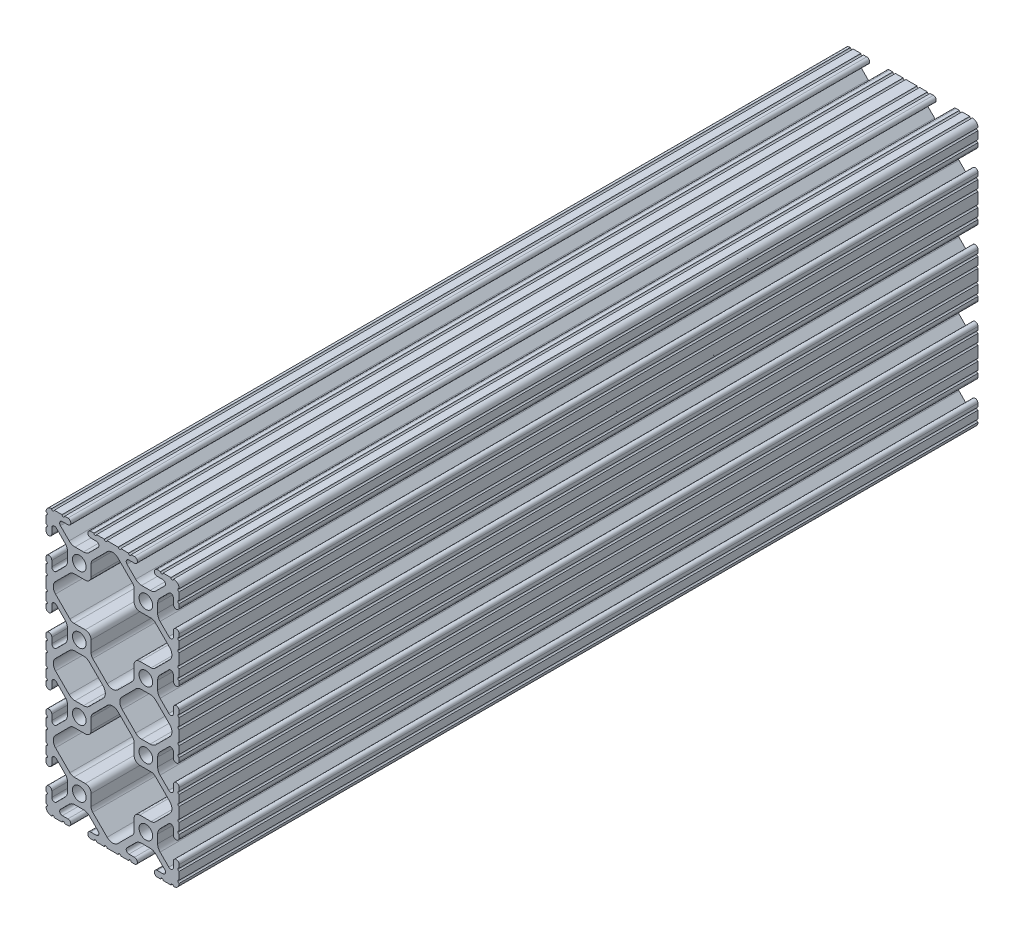
from build123d import *

# Parameters (mm, degrees)
SKETCH1_R      = 2.6035
EXTRUDE1_DEPTH = 304.8


with BuildPart() as part:
    # Sketch1 → Extrude1 (new body)
    with BuildSketch(Plane.XY):
        with BuildLine():
            Line((-12.699984366, 40.2336), (-12.699984366, 35.9664))
            ThreePointArc((-12.699984366, 35.9664), (-12.192, 35.458392183), (-12.7, 34.9504))
            Line((-12.7, 34.9504), (-12.7, 32.004))
            ThreePointArc((-12.7, 32.004), (-12.192, 31.496), (-12.7, 30.988))
            Line((-12.7, 30.988), (-12.7, 29.7434))
            ThreePointArc((-12.7, 29.7434), (-11.5951, 28.6385), (-10.4902, 29.7434))
            Line((-10.4902, 29.7434), (-10.4902, 31.874256981))
            ThreePointArc((-10.4902, 31.874256981), (-9.863010627, 32.812916821), (-8.755786031, 32.592683991))
            Line((-8.755786031, 32.592683991), (-5.425756348, 29.262714761))
            ThreePointArc((-5.425756348, 29.262714761), (-4.737487999, 28.232663563), (-4.4958, 27.017630353))
            Line((-4.4958, 27.017630353), (-4.4958, 23.782369647))
            ThreePointArc((-4.4958, 23.782369647), (-4.737487999, 22.567336437), (-5.425756348, 21.537285239))
            Line((-5.425756348, 21.537285239), (-8.755786031, 18.207316009))
            ThreePointArc((-8.755786031, 18.207316009), (-9.863010627, 17.987083179), (-10.4902, 18.925743019))
            Line((-10.4902, 18.925743019), (-10.4902, 21.0566))
            ThreePointArc((-10.4902, 21.0566), (-11.5951, 22.1615), (-12.7, 21.0566))
            Line((-12.7, 21.0566), (-12.7, 19.812))
            ThreePointArc((-12.7, 19.812), (-12.192, 19.304), (-12.7, 18.796))
            Line((-12.7, 18.796), (-12.7, 15.8496))
            ThreePointArc((-12.7, 15.8496), (-12.192, 15.341607817), (-12.699984366, 14.8336))
            Line((-12.699984366, 14.8336), (-12.699984366, 10.5664))
            ThreePointArc((-12.699984366, 10.5664), (-12.192, 10.0584), (-12.699984366, 9.5504))
            Line((-12.699984366, 9.5504), (-12.699984366, 6.604))
            ThreePointArc((-12.699984366, 6.604), (-12.192, 6.095992183), (-12.7, 5.588))
            Line((-12.7, 5.588), (-12.7, 4.3434))
            ThreePointArc((-12.7, 4.3434), (-11.5951, 3.2385), (-10.4902, 4.3434))
            Line((-10.4902, 4.3434), (-10.4902, 6.474256981))
            ThreePointArc((-10.4902, 6.474256981), (-9.863010627, 7.412916821), (-8.755786031, 7.192683991))
            Line((-8.755786031, 7.192683991), (-5.425756348, 3.862714761))
            ThreePointArc((-5.425756348, 3.862714761), (-4.737487999, 2.832663563), (-4.4958, 1.617630353))
            Line((-4.4958, 1.617630353), (-4.4958, -1.617630353))
            ThreePointArc((-4.4958, -1.617630353), (-4.737487999, -2.832663563), (-5.425756348, -3.862714761))
            Line((-5.425756348, -3.862714761), (-8.755786031, -7.192683991))
            ThreePointArc((-8.755786031, -7.192683991), (-9.863010627, -7.412916821), (-10.4902, -6.474256981))
            Line((-10.4902, -6.474256981), (-10.4902, -4.3434))
            ThreePointArc((-10.4902, -4.3434), (-11.5951, -3.2385), (-12.7, -4.3434))
            Line((-12.7, -4.3434), (-12.7, -5.588))
            ThreePointArc((-12.7, -5.588), (-12.192, -6.096), (-12.7, -6.604))
            Line((-12.7, -6.604), (-12.7, -9.5504))
            ThreePointArc((-12.7, -9.5504), (-12.192000007, -10.058315768), (-12.699831537, -10.566399972))
            ThreePointArc((-12.699831537, -10.566399972), (-12.082506882, -12.082506882), (-10.566399972, -12.699831537))
            ThreePointArc((-10.566399972, -12.699831537), (-10.058315768, -12.192000007), (-9.5504, -12.7))
            Line((-9.5504, -12.7), (-6.604, -12.7))
            ThreePointArc((-6.604, -12.7), (-6.096, -12.192), (-5.588, -12.7))
            Line((-5.588, -12.7), (-4.3434, -12.7))
            ThreePointArc((-4.3434, -12.7), (-3.2385, -11.5951), (-4.3434, -10.4902))
            Line((-4.3434, -10.4902), (-6.474256981, -10.4902))
            ThreePointArc((-6.474256981, -10.4902), (-7.412916821, -9.863010627), (-7.192683991, -8.755786031))
            Line((-7.192683991, -8.755786031), (-3.862714761, -5.425756348))
            ThreePointArc((-3.862714761, -5.425756348), (-2.832663563, -4.737487999), (-1.617630353, -4.4958))
            Line((-1.617630353, -4.4958), (1.617630353, -4.4958))
            ThreePointArc((1.617630353, -4.4958), (2.832663563, -4.737487999), (3.862714761, -5.425756348))
            Line((3.862714761, -5.425756348), (7.192683991, -8.755786031))
            ThreePointArc((7.192683991, -8.755786031), (7.412916821, -9.863010627), (6.474256981, -10.4902))
            Line((6.474256981, -10.4902), (4.3434, -10.4902))
            ThreePointArc((4.3434, -10.4902), (3.2385, -11.5951), (4.3434, -12.7))
            Line((4.3434, -12.7), (5.588, -12.7))
            ThreePointArc((5.588, -12.7), (6.096, -12.192), (6.604, -12.7))
            Line((6.604, -12.7), (9.5504, -12.7))
            ThreePointArc((9.5504, -12.7), (10.0584, -12.192), (10.5664, -12.7))
            Line((10.5664, -12.7), (14.8336, -12.7))
            ThreePointArc((14.8336, -12.7), (15.3416, -12.192), (15.8496, -12.7))
            Line((15.8496, -12.7), (18.796, -12.7))
            ThreePointArc((18.796, -12.7), (19.304, -12.192), (19.812, -12.7))
            Line((19.812, -12.7), (21.0566, -12.7))
            ThreePointArc((21.0566, -12.7), (22.1615, -11.5951), (21.0566, -10.4902))
            Line((21.0566, -10.4902), (18.925743019, -10.4902))
            ThreePointArc((18.925743019, -10.4902), (17.987083179, -9.863010627), (18.207316009, -8.755786031))
            Line((18.207316009, -8.755786031), (21.537285239, -5.425756348))
            ThreePointArc((21.537285239, -5.425756348), (22.567336437, -4.737487999), (23.782369647, -4.4958))
            Line((23.782369647, -4.4958), (27.017630353, -4.4958))
            ThreePointArc((27.017630353, -4.4958), (28.232663563, -4.737487999), (29.262714761, -5.425756348))
            Line((29.262714761, -5.425756348), (32.592683991, -8.755786031))
            ThreePointArc((32.592683991, -8.755786031), (32.812916821, -9.863010627), (31.874256981, -10.4902))
            Line((31.874256981, -10.4902), (29.7434, -10.4902))
            ThreePointArc((29.7434, -10.4902), (28.6385, -11.5951), (29.7434, -12.7))
            Line((29.7434, -12.7), (30.988, -12.7))
            ThreePointArc((30.988, -12.7), (31.496, -12.192), (32.004, -12.7))
            Line((32.004, -12.7), (34.9504, -12.7))
            ThreePointArc((34.9504, -12.7), (35.458315768, -12.192000007), (35.966399972, -12.699831537))
            ThreePointArc((35.966399972, -12.699831537), (37.482506882, -12.082506882), (38.099831537, -10.566399972))
            ThreePointArc((38.099831537, -10.566399972), (37.592000007, -10.058315768), (38.1, -9.5504))
            Line((38.1, -9.5504), (38.1, -6.604))
            ThreePointArc((38.1, -6.604), (37.592, -6.096), (38.1, -5.588))
            Line((38.1, -5.588), (38.1, -4.3434))
            ThreePointArc((38.1, -4.3434), (36.9951, -3.2385), (35.8902, -4.3434))
            Line((35.8902, -4.3434), (35.8902, -6.474256981))
            ThreePointArc((35.8902, -6.474256981), (35.263010627, -7.412916821), (34.155786031, -7.192683991))
            Line((34.155786031, -7.192683991), (30.825756348, -3.862714761))
            ThreePointArc((30.825756348, -3.862714761), (30.137487999, -2.832663563), (29.8958, -1.617630353))
            Line((29.8958, -1.617630353), (29.8958, 1.617630353))
            ThreePointArc((29.8958, 1.617630353), (30.137487999, 2.832663563), (30.825756348, 3.862714761))
            Line((30.825756348, 3.862714761), (34.155786031, 7.192683991))
            ThreePointArc((34.155786031, 7.192683991), (35.263010627, 7.412916821), (35.8902, 6.474256981))
            Line((35.8902, 6.474256981), (35.8902, 4.3434))
            ThreePointArc((35.8902, 4.3434), (36.9951, 3.2385), (38.1, 4.3434))
            Line((38.1, 4.3434), (38.1, 5.588))
            ThreePointArc((38.1, 5.588), (37.592, 6.096), (38.1, 6.604))
            Line((38.1, 6.604), (38.1, 9.5504))
            ThreePointArc((38.1, 9.5504), (37.592, 10.058392183), (38.099984366, 10.5664))
            Line((38.099984366, 10.5664), (38.099984366, 14.8336))
            ThreePointArc((38.099984366, 14.8336), (37.592, 15.3416), (38.099984366, 15.8496))
            Line((38.099984366, 15.8496), (38.099984366, 18.796))
            ThreePointArc((38.099984366, 18.796), (37.592, 19.304007817), (38.1, 19.812))
            Line((38.1, 19.812), (38.1, 21.0566))
            ThreePointArc((38.1, 21.0566), (36.9951, 22.1615), (35.8902, 21.0566))
            Line((35.8902, 21.0566), (35.8902, 18.925743019))
            ThreePointArc((35.8902, 18.925743019), (35.263010627, 17.987083179), (34.155786031, 18.207316009))
            Line((34.155786031, 18.207316009), (30.825756348, 21.537285239))
            ThreePointArc((30.825756348, 21.537285239), (30.137487999, 22.567336437), (29.8958, 23.782369647))
            Line((29.8958, 23.782369647), (29.8958, 27.017630353))
            ThreePointArc((29.8958, 27.017630353), (30.137487999, 28.232663563), (30.825756348, 29.262714761))
            Line((30.825756348, 29.262714761), (34.155786031, 32.592683991))
            ThreePointArc((34.155786031, 32.592683991), (35.263010627, 32.812916821), (35.8902, 31.874256981))
            Line((35.8902, 31.874256981), (35.8902, 29.7434))
            ThreePointArc((35.8902, 29.7434), (36.9951, 28.6385), (38.1, 29.7434))
            Line((38.1, 29.7434), (38.1, 30.988))
            ThreePointArc((38.1, 30.988), (37.592, 31.495992183), (38.099984366, 32.004))
            Line((38.099984366, 32.004), (38.099984366, 34.9504))
            ThreePointArc((38.099984366, 34.9504), (37.592, 35.4584), (38.099984366, 35.9664))
            Line((38.099984366, 35.9664), (38.099984366, 40.2336))
            ThreePointArc((38.099984366, 40.2336), (37.592, 40.7416), (38.099984366, 41.2496))
            Line((38.099984366, 41.2496), (38.099984366, 44.196))
            ThreePointArc((38.099984366, 44.196), (37.592, 44.704007817), (38.1, 45.212))
            Line((38.1, 45.212), (38.1, 46.4566))
            ThreePointArc((38.1, 46.4566), (36.9951, 47.5615), (35.8902, 46.4566))
            Line((35.8902, 46.4566), (35.8902, 44.325743019))
            ThreePointArc((35.8902, 44.325743019), (35.263010627, 43.387083179), (34.155786031, 43.607316009))
            Line((34.155786031, 43.607316009), (30.825756348, 46.937285239))
            ThreePointArc((30.825756348, 46.937285239), (30.137487999, 47.967336437), (29.8958, 49.182369647))
            Line((29.8958, 49.182369647), (29.8958, 52.417630353))
            ThreePointArc((29.8958, 52.417630353), (30.137487999, 53.632663563), (30.825756348, 54.662714761))
            Line((30.825756348, 54.662714761), (34.155786031, 57.992683991))
            ThreePointArc((34.155786031, 57.992683991), (35.263010627, 58.212916821), (35.8902, 57.274256981))
            Line((35.8902, 57.274256981), (35.8902, 55.1434))
            ThreePointArc((35.8902, 55.1434), (36.9951, 54.0385), (38.1, 55.1434))
            Line((38.1, 55.1434), (38.1, 56.388))
            ThreePointArc((38.1, 56.388), (37.592, 56.896), (38.1, 57.404))
            Line((38.1, 57.404), (38.1, 60.3504))
            ThreePointArc((38.1, 60.3504), (37.592, 60.858392183), (38.099984366, 61.3664))
            Line((38.099984366, 61.3664), (38.099984366, 65.6336))
            ThreePointArc((38.099984366, 65.6336), (37.592, 66.141607817), (38.1, 66.6496))
            Line((38.1, 66.6496), (38.1, 69.596))
            ThreePointArc((38.1, 69.596), (37.592, 70.104), (38.1, 70.612))
            Line((38.1, 70.612), (38.1, 71.8566))
            ThreePointArc((38.1, 71.8566), (36.9951, 72.9615), (35.8902, 71.8566))
            Line((35.8902, 71.8566), (35.8902, 69.725743019))
            ThreePointArc((35.8902, 69.725743019), (35.263010627, 68.787083179), (34.155786031, 69.007316009))
            Line((34.155786031, 69.007316009), (30.825756348, 72.337285239))
            ThreePointArc((30.825756348, 72.337285239), (30.137487999, 73.367336437), (29.8958, 74.582369647))
            Line((29.8958, 74.582369647), (29.8958, 77.817630353))
            ThreePointArc((29.8958, 77.817630353), (30.137487999, 79.032663563), (30.825756348, 80.062714761))
            Line((30.825756348, 80.062714761), (34.155786031, 83.392683991))
            ThreePointArc((34.155786031, 83.392683991), (35.263010627, 83.612916821), (35.8902, 82.674256981))
            Line((35.8902, 82.674256981), (35.8902, 80.5434))
            ThreePointArc((35.8902, 80.5434), (36.9951, 79.4385), (38.1, 80.5434))
            Line((38.1, 80.5434), (38.1, 81.788))
            ThreePointArc((38.1, 81.788), (37.592, 82.296), (38.1, 82.804))
            Line((38.1, 82.804), (38.1, 85.7504))
            ThreePointArc((38.1, 85.7504), (37.592000007, 86.258315768), (38.099831537, 86.766399972))
            ThreePointArc((38.099831537, 86.766399972), (37.482506882, 88.282506882), (35.966399972, 88.899831537))
            ThreePointArc((35.966399972, 88.899831537), (35.458315768, 88.392000007), (34.9504, 88.9))
            Line((34.9504, 88.9), (32.004, 88.9))
            ThreePointArc((32.004, 88.9), (31.496, 88.392), (30.988, 88.9))
            Line((30.988, 88.9), (29.7434, 88.9))
            ThreePointArc((29.7434, 88.9), (28.6385, 87.7951), (29.7434, 86.6902))
            Line((29.7434, 86.6902), (31.874256981, 86.6902))
            ThreePointArc((31.874256981, 86.6902), (32.812916821, 86.063010627), (32.592683991, 84.955786031))
            Line((32.592683991, 84.955786031), (29.262714761, 81.625756348))
            ThreePointArc((29.262714761, 81.625756348), (28.232663563, 80.937487999), (27.017630353, 80.6958))
            Line((27.017630353, 80.6958), (23.782369647, 80.6958))
            ThreePointArc((23.782369647, 80.6958), (22.567336437, 80.937487999), (21.537285239, 81.625756348))
            Line((21.537285239, 81.625756348), (18.207316009, 84.955786031))
            ThreePointArc((18.207316009, 84.955786031), (17.987083179, 86.063010627), (18.925743019, 86.6902))
            Line((18.925743019, 86.6902), (21.0566, 86.6902))
            ThreePointArc((21.0566, 86.6902), (22.1615, 87.7951), (21.0566, 88.9))
            Line((21.0566, 88.9), (19.812, 88.9))
            ThreePointArc((19.812, 88.9), (19.304, 88.392), (18.796, 88.9))
            Line((18.796, 88.9), (15.8496, 88.9))
            ThreePointArc((15.8496, 88.9), (15.3416, 88.392), (14.8336, 88.9))
            Line((14.8336, 88.9), (10.5664, 88.9))
            ThreePointArc((10.5664, 88.9), (10.0584, 88.392), (9.5504, 88.9))
            Line((9.5504, 88.9), (6.604, 88.9))
            ThreePointArc((6.604, 88.9), (6.096, 88.392), (5.588, 88.9))
            Line((5.588, 88.9), (4.3434, 88.9))
            ThreePointArc((4.3434, 88.9), (3.2385, 87.7951), (4.3434, 86.6902))
            Line((4.3434, 86.6902), (6.474256981, 86.6902))
            ThreePointArc((6.474256981, 86.6902), (7.412916821, 86.063010627), (7.192683991, 84.955786031))
            Line((7.192683991, 84.955786031), (3.862714761, 81.625756348))
            ThreePointArc((3.862714761, 81.625756348), (2.832663563, 80.937487999), (1.617630353, 80.6958))
            Line((1.617630353, 80.6958), (-1.617630353, 80.6958))
            ThreePointArc((-1.617630353, 80.6958), (-2.832663563, 80.937487999), (-3.862714761, 81.625756348))
            Line((-3.862714761, 81.625756348), (-7.192683991, 84.955786031))
            ThreePointArc((-7.192683991, 84.955786031), (-7.412916821, 86.063010627), (-6.474256981, 86.6902))
            Line((-6.474256981, 86.6902), (-4.3434, 86.6902))
            ThreePointArc((-4.3434, 86.6902), (-3.2385, 87.7951), (-4.3434, 88.9))
            Line((-4.3434, 88.9), (-5.588, 88.9))
            ThreePointArc((-5.588, 88.9), (-6.096, 88.392), (-6.604, 88.9))
            Line((-6.604, 88.9), (-9.5504, 88.9))
            ThreePointArc((-9.5504, 88.9), (-10.058315768, 88.392000007), (-10.566399972, 88.899831537))
            ThreePointArc((-10.566399972, 88.899831537), (-12.082506882, 88.282506882), (-12.699831537, 86.766399972))
            ThreePointArc((-12.699831537, 86.766399972), (-12.192000007, 86.258315768), (-12.7, 85.7504))
            Line((-12.7, 85.7504), (-12.7, 82.804))
            ThreePointArc((-12.7, 82.804), (-12.192, 82.296), (-12.7, 81.788))
            Line((-12.7, 81.788), (-12.7, 80.5434))
            ThreePointArc((-12.7, 80.5434), (-11.5951, 79.4385), (-10.4902, 80.5434))
            Line((-10.4902, 80.5434), (-10.4902, 82.674256981))
            ThreePointArc((-10.4902, 82.674256981), (-9.863010627, 83.612916821), (-8.755786031, 83.392683991))
            Line((-8.755786031, 83.392683991), (-5.425756348, 80.062714761))
            ThreePointArc((-5.425756348, 80.062714761), (-4.737487999, 79.032663563), (-4.4958, 77.817630353))
            Line((-4.4958, 77.817630353), (-4.4958, 74.582369647))
            ThreePointArc((-4.4958, 74.582369647), (-4.737487999, 73.367336437), (-5.425756348, 72.337285239))
            Line((-5.425756348, 72.337285239), (-8.755786031, 69.007316009))
            ThreePointArc((-8.755786031, 69.007316009), (-9.863010627, 68.787083179), (-10.4902, 69.725743019))
            Line((-10.4902, 69.725743019), (-10.4902, 71.8566))
            ThreePointArc((-10.4902, 71.8566), (-11.5951, 72.9615), (-12.7, 71.8566))
            Line((-12.7, 71.8566), (-12.7, 70.612))
            ThreePointArc((-12.7, 70.612), (-12.192, 70.104), (-12.7, 69.596))
            Line((-12.7, 69.596), (-12.7, 66.6496))
            ThreePointArc((-12.7, 66.6496), (-12.192, 66.141607817), (-12.699984366, 65.6336))
            Line((-12.699984366, 65.6336), (-12.699984366, 61.3664))
            ThreePointArc((-12.699984366, 61.3664), (-12.192, 60.858392183), (-12.7, 60.3504))
            Line((-12.7, 60.3504), (-12.7, 57.404))
            ThreePointArc((-12.7, 57.404), (-12.192, 56.896), (-12.7, 56.388))
            Line((-12.7, 56.388), (-12.7, 55.1434))
            ThreePointArc((-12.7, 55.1434), (-11.5951, 54.0385), (-10.4902, 55.1434))
            Line((-10.4902, 55.1434), (-10.4902, 57.274256981))
            ThreePointArc((-10.4902, 57.274256981), (-9.863010627, 58.212916821), (-8.755786031, 57.992683991))
            Line((-8.755786031, 57.992683991), (-5.425756348, 54.662714761))
            ThreePointArc((-5.425756348, 54.662714761), (-4.737487999, 53.632663563), (-4.4958, 52.417630353))
            Line((-4.4958, 52.417630353), (-4.4958, 49.182369647))
            ThreePointArc((-4.4958, 49.182369647), (-4.737487999, 47.967336437), (-5.425756348, 46.937285239))
            Line((-5.425756348, 46.937285239), (-8.755786031, 43.607316009))
            ThreePointArc((-8.755786031, 43.607316009), (-9.863010627, 43.387083179), (-10.4902, 44.325743019))
            Line((-10.4902, 44.325743019), (-10.4902, 46.4566))
            ThreePointArc((-10.4902, 46.4566), (-11.5951, 47.5615), (-12.7, 46.4566))
            Line((-12.7, 46.4566), (-12.7, 45.212))
            ThreePointArc((-12.7, 45.212), (-12.192, 44.704), (-12.7, 44.196))
            Line((-12.7, 44.196), (-12.7, 41.2496))
            ThreePointArc((-12.7, 41.2496), (-12.192, 40.741607817), (-12.699984366, 40.2336))
        make_face()
        with Locations((25.4, 76.2)):
            Circle(SKETCH1_R, mode=Mode.SUBTRACT)
        with Locations((0, 76.2)):
            Circle(SKETCH1_R, mode=Mode.SUBTRACT)
        with Locations((25.4, 50.8)):
            Circle(SKETCH1_R, mode=Mode.SUBTRACT)
        with Locations((0, 50.8)):
            Circle(SKETCH1_R, mode=Mode.SUBTRACT)
        with Locations((25.4, 0)):
            Circle(SKETCH1_R, mode=Mode.SUBTRACT)
        Circle(SKETCH1_R, mode=Mode.SUBTRACT)
        with Locations((25.4, 25.4)):
            Circle(SKETCH1_R, mode=Mode.SUBTRACT)
        with Locations((0, 25.4)):
            Circle(SKETCH1_R, mode=Mode.SUBTRACT)
        with BuildLine():
            Line((2.286, 55.2958), (-2.018378203, 55.2958))
            ThreePointArc((-2.018378203, 55.2958), (-2.864022786, 55.464007171), (-3.580928584, 55.943021252))
            Line((-3.580928584, 55.943021252), (-9.072529371, 61.434522344))
            ThreePointArc((-9.072529371, 61.434522344), (-9.928089211, 63.5), (-9.072529371, 65.565477656))
            Line((-9.072529371, 65.565477656), (-3.580928584, 71.056978748))
            ThreePointArc((-3.580928584, 71.056978748), (-2.864022786, 71.535992829), (-2.018378203, 71.7042))
            Line((-2.018378203, 71.7042), (2.286, 71.7042))
            ThreePointArc((2.286, 71.7042), (3.848564565, 72.351435435), (4.4958, 73.914))
            Line((4.4958, 73.914), (4.4958, 78.218378203))
            ThreePointArc((4.4958, 78.218378203), (4.664007171, 79.064022786), (5.143021252, 79.780928584))
            Line((5.143021252, 79.780928584), (10.634522344, 85.272529371))
            ThreePointArc((10.634522344, 85.272529371), (12.7, 86.128089211), (14.765477656, 85.272529371))
            Line((14.765477656, 85.272529371), (20.256978748, 79.780928584))
            ThreePointArc((20.256978748, 79.780928584), (20.735992829, 79.064022786), (20.9042, 78.218378203))
            Line((20.9042, 78.218378203), (20.9042, 73.914))
            ThreePointArc((20.9042, 73.914), (21.551435435, 72.351435435), (23.114, 71.7042))
            Line((23.114, 71.7042), (27.418378203, 71.7042))
            ThreePointArc((27.418378203, 71.7042), (28.264022786, 71.535992829), (28.980928584, 71.056978748))
            Line((28.980928584, 71.056978748), (34.472529371, 65.565477656))
            ThreePointArc((34.472529371, 65.565477656), (35.328089211, 63.5), (34.472529371, 61.434522344))
            Line((34.472529371, 61.434522344), (28.980928584, 55.943021252))
            ThreePointArc((28.980928584, 55.943021252), (28.264022786, 55.464007171), (27.418378203, 55.2958))
            Line((27.418378203, 55.2958), (23.114, 55.2958))
            ThreePointArc((23.114, 55.2958), (21.551435435, 54.648564565), (20.9042, 53.086))
            Line((20.9042, 53.086), (20.9042, 48.781621797))
            ThreePointArc((20.9042, 48.781621797), (20.735992829, 47.935977214), (20.256978748, 47.219071416))
            Line((20.256978748, 47.219071416), (14.765477656, 41.727470629))
            ThreePointArc((14.765477656, 41.727470629), (12.7, 40.871910789), (10.634522344, 41.727470629))
            Line((10.634522344, 41.727470629), (5.143021252, 47.219071416))
            ThreePointArc((5.143021252, 47.219071416), (4.664007171, 47.935977214), (4.4958, 48.781621797))
            Line((4.4958, 48.781621797), (4.4958, 53.086))
            ThreePointArc((4.4958, 53.086), (3.848564565, 54.648564565), (2.286, 55.2958))
        make_face(mode=Mode.SUBTRACT)
        with BuildLine():
            Line((4.4958, 23.114), (4.4958, 27.418378203))
            ThreePointArc((4.4958, 27.418378203), (4.664007171, 28.264022786), (5.143021252, 28.980928584))
            Line((5.143021252, 28.980928584), (10.634522344, 34.472529371))
            ThreePointArc((10.634522344, 34.472529371), (12.7, 35.328089211), (14.765477656, 34.472529371))
            Line((14.765477656, 34.472529371), (20.256978748, 28.980928584))
            ThreePointArc((20.256978748, 28.980928584), (20.735992829, 28.264022786), (20.9042, 27.418378203))
            Line((20.9042, 27.418378203), (20.9042, 23.114))
            ThreePointArc((20.9042, 23.114), (21.551435435, 21.551435435), (23.114, 20.9042))
            Line((23.114, 20.9042), (27.418378203, 20.9042))
            ThreePointArc((27.418378203, 20.9042), (28.264022786, 20.735992829), (28.980928584, 20.256978748))
            Line((28.980928584, 20.256978748), (34.472529371, 14.765477656))
            ThreePointArc((34.472529371, 14.765477656), (35.328089211, 12.7), (34.472529371, 10.634522344))
            Line((34.472529371, 10.634522344), (28.980928584, 5.143021252))
            ThreePointArc((28.980928584, 5.143021252), (28.264022786, 4.664007171), (27.418378203, 4.4958))
            Line((27.418378203, 4.4958), (23.114, 4.4958))
            ThreePointArc((23.114, 4.4958), (21.551435435, 3.848564565), (20.9042, 2.286))
            Line((20.9042, 2.286), (20.9042, -2.018378203))
            ThreePointArc((20.9042, -2.018378203), (20.735992829, -2.864022786), (20.256978748, -3.580928584))
            Line((20.256978748, -3.580928584), (14.765477656, -9.072529371))
            ThreePointArc((14.765477656, -9.072529371), (12.7, -9.928089211), (10.634522344, -9.072529371))
            Line((10.634522344, -9.072529371), (5.143021252, -3.580928584))
            ThreePointArc((5.143021252, -3.580928584), (4.664007171, -2.864022786), (4.4958, -2.018378203))
            Line((4.4958, -2.018378203), (4.4958, 2.286))
            ThreePointArc((4.4958, 2.286), (3.848564565, 3.848564565), (2.286, 4.4958))
            Line((2.286, 4.4958), (-2.018378203, 4.4958))
            ThreePointArc((-2.018378203, 4.4958), (-2.864022786, 4.664007171), (-3.580928584, 5.143021252))
            Line((-3.580928584, 5.143021252), (-9.072529371, 10.634522344))
            ThreePointArc((-9.072529371, 10.634522344), (-9.928089211, 12.7), (-9.072529371, 14.765477656))
            Line((-9.072529371, 14.765477656), (-3.580928584, 20.256978748))
            ThreePointArc((-3.580928584, 20.256978748), (-2.864022786, 20.735992829), (-2.018378203, 20.9042))
            Line((-2.018378203, 20.9042), (2.286, 20.9042))
            ThreePointArc((2.286, 20.9042), (3.848564565, 21.551435435), (4.4958, 23.114))
        make_face(mode=Mode.SUBTRACT)
        with BuildLine():
            Line((27.018584404, 29.8958), (23.782369647, 29.8958))
            ThreePointArc((23.782369647, 29.8958), (22.567336437, 30.137487999), (21.537285239, 30.825756348))
            Line((21.537285239, 30.825756348), (16.328576307, 36.03455984))
            ThreePointArc((16.328576307, 36.03455984), (15.473053963, 38.1), (16.328576307, 40.16544016))
            Line((16.328576307, 40.16544016), (21.537285239, 45.374243652))
            ThreePointArc((21.537285239, 45.374243652), (22.567336437, 46.062512001), (23.782369647, 46.3042))
            Line((23.782369647, 46.3042), (27.018584404, 46.3042))
            ThreePointArc((27.018584404, 46.3042), (28.233590989, 46.06252303), (29.263628056, 45.374284409))
            Line((29.263628056, 45.374284409), (34.472529371, 40.165477656))
            ThreePointArc((34.472529371, 40.165477656), (35.328089211, 38.1), (34.472529371, 36.034522344))
            Line((34.472529371, 36.034522344), (29.263628056, 30.825715591))
            ThreePointArc((29.263628056, 30.825715591), (28.233590989, 30.13747697), (27.018584404, 29.8958))
        make_face(mode=Mode.SUBTRACT)
        with BuildLine():
            Line((1.617630353, 29.8958), (-1.618584404, 29.8958))
            ThreePointArc((-1.618584404, 29.8958), (-2.833590989, 30.13747697), (-3.863628056, 30.825715591))
            Line((-3.863628056, 30.825715591), (-9.072529371, 36.034522344))
            ThreePointArc((-9.072529371, 36.034522344), (-9.928089211, 38.1), (-9.072529371, 40.165477656))
            Line((-9.072529371, 40.165477656), (-3.863628056, 45.374284409))
            ThreePointArc((-3.863628056, 45.374284409), (-2.833590989, 46.06252303), (-1.618584404, 46.3042))
            Line((-1.618584404, 46.3042), (1.617630353, 46.3042))
            ThreePointArc((1.617630353, 46.3042), (2.832663563, 46.062512001), (3.862714761, 45.374243652))
            Line((3.862714761, 45.374243652), (9.071423693, 40.16544016))
            ThreePointArc((9.071423693, 40.16544016), (9.926946037, 38.1), (9.071423693, 36.03455984))
            Line((9.071423693, 36.03455984), (3.862714761, 30.825756348))
            ThreePointArc((3.862714761, 30.825756348), (2.832663563, 30.137487999), (1.617630353, 29.8958))
        make_face(mode=Mode.SUBTRACT)
    extrude(amount=-EXTRUDE1_DEPTH)


solid = part.part
